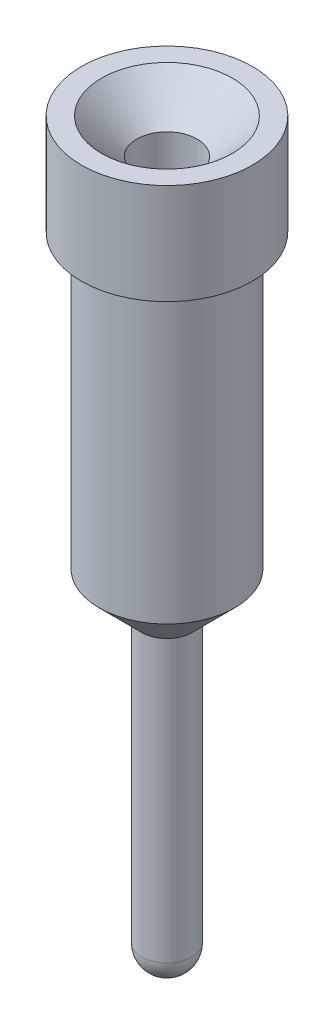
from build123d import *


with BuildPart() as part:
    # Sketch1 → Revolve1 (revolve)
    with BuildSketch(Plane.XY, mode=Mode.PRIVATE) as revolve1_sk:
        with BuildLine():
            Line((-0.85, 0), (-0.65, 0))
            Line((-0.65, 0), (-0.3, -0.35))
            Line((-0.3, -0.35), (-0.3, -3.7))
            Line((-0.3, -3.7), (0, -4))
            Line((0, -4), (0, -7.37))
            ThreePointArc((0, -7.37), (-0.176776695, -7.296776695), (-0.25, -7.12))
            Line((-0.25, -7.12), (-0.25, -4.325))
            Line((-0.25, -4.325), (-0.675, -3.9))
            Line((-0.675, -3.9), (-0.675, -1))
            Line((-0.675, -1), (-0.85, -1))
            Line((-0.85, -1), (-0.85, 0))
        make_face()
    revolve(revolve1_sk.sketch.rotate(Axis((0, 0, 0), (0, -1, 0)), 270), axis=Axis((0, 0, 0), (0, -1, 0)))


solid = part.part
